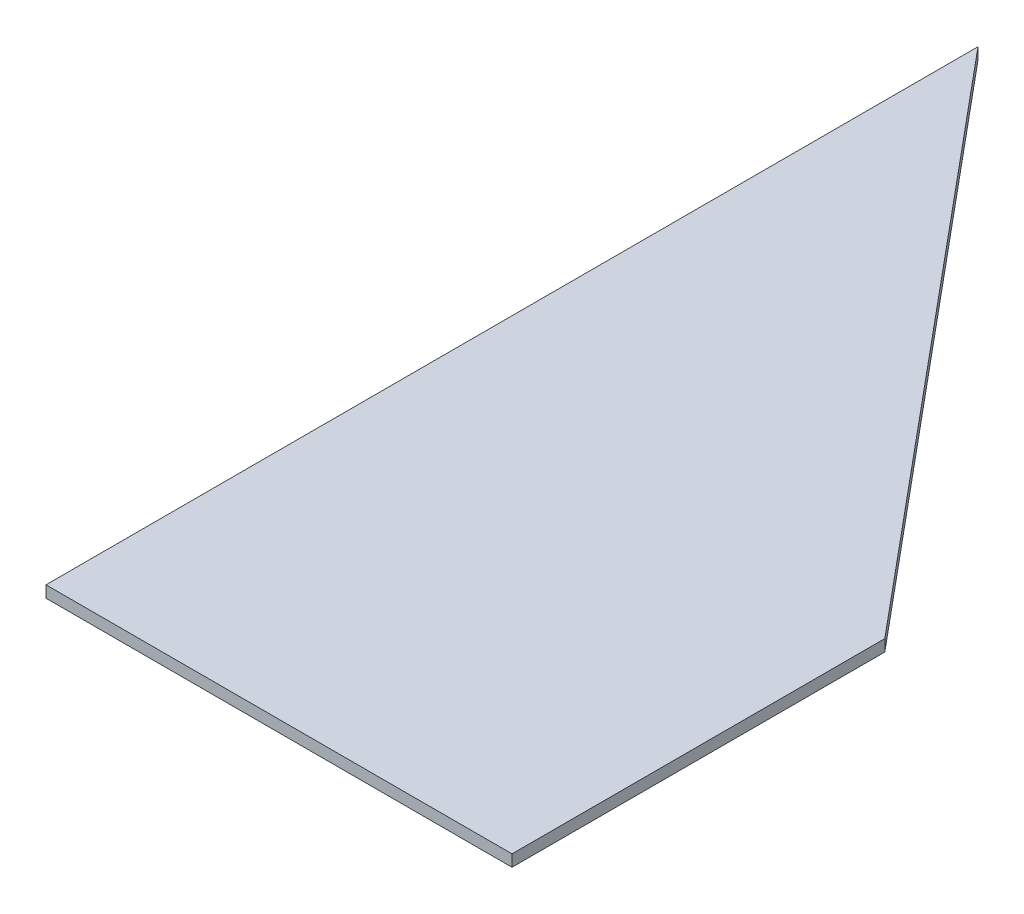
from build123d import *

# Parameters (mm, degrees)
FINBODY_DEPTH = 3.175


with BuildPart() as part:
    # Sketch1 → FinBody (new body)
    with BuildSketch(Plane(origin=(0, 0, 0), x_dir=(1, 0, 0), z_dir=(0, 1, 0))):
        Polygon((0, 0), (0, 254), (127, 101.6), (127, 0), align=None)
    extrude(amount=FINBODY_DEPTH)


solid = part.part
